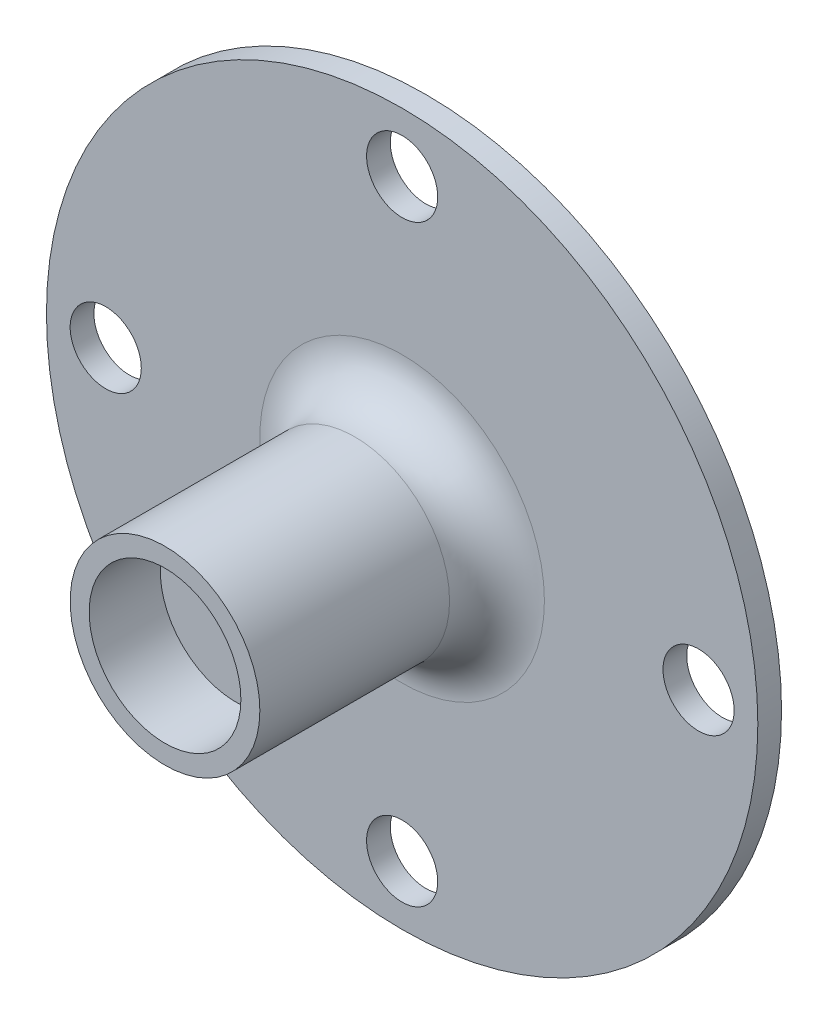
from build123d import *

# Parameters (mm, degrees)
SKETCH1_R           = 15
SKETCH1_R_2         = 4
SKETCH1_R_3         = 1.5
BOSS_EXTRUDE1_DEPTH = 1
SKETCH1_4_R         = 4
SKETCH1_4_R_2       = 3.2
BOSS_EXTRUDE2_DEPTH = 11
SKETCH1_5_R         = 3.2
BOSS_EXTRUDE3_DEPTH = 8
FILLET1_R           = 2


with BuildPart() as part:
    # Sketch1 → Boss-Extrude1 (new body)
    with BuildSketch(Plane.XY):
        Circle(SKETCH1_R)
        Circle(SKETCH1_R_2, mode=Mode.SUBTRACT)
        with Locations((0, 12.5)):
            Circle(SKETCH1_R_3, mode=Mode.SUBTRACT)
        with Locations((12.5, 0)):
            Circle(SKETCH1_R_3, mode=Mode.SUBTRACT)
        with Locations((0, -12.5)):
            Circle(SKETCH1_R_3, mode=Mode.SUBTRACT)
        with Locations((-12.5, 0)):
            Circle(SKETCH1_R_3, mode=Mode.SUBTRACT)
    extrude(amount=BOSS_EXTRUDE1_DEPTH)

    # Sketch1<4> → Boss-Extrude2 (add)
    with BuildSketch(Plane.XY):
        Circle(SKETCH1_4_R)
        Circle(SKETCH1_4_R_2, mode=Mode.SUBTRACT)
    extrude(amount=BOSS_EXTRUDE2_DEPTH)

    # Sketch1<5> → Boss-Extrude3 (add)
    with BuildSketch(Plane.XY):
        Circle(SKETCH1_5_R)
    extrude(amount=BOSS_EXTRUDE3_DEPTH)

    # Fillet1
    fillet1_edges = [part.edges().sort_by_distance(p)[0] for p in [
        (-4, 0, 1),
    ]]
    fillet(fillet1_edges, radius=FILLET1_R)


solid = part.part
